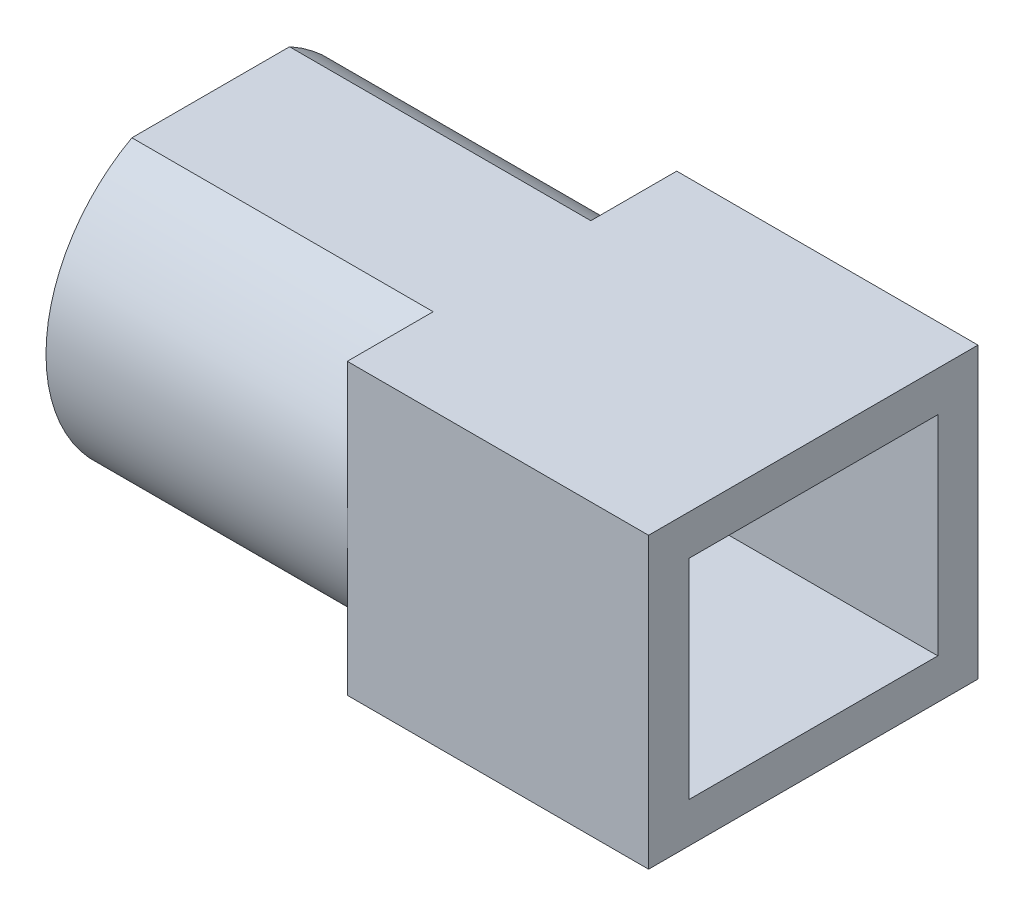
from build123d import *

# Parameters (mm, degrees)
BOSS_EXTRUDE1_START = 30
SKETCH1_W           = 16.4
SKETCH1_H           = 14.4
SKETCH1_W_2         = 12.4
SKETCH1_H_2         = 10.4
BOSS_EXTRUDE1_DEPTH = 15
BOSS_EXTRUDE2_START = 30
BOSS_EXTRUDE2_DEPTH = 15


with BuildPart() as part:
    # Sketch1 → Boss-Extrude1 (new body)
    with BuildSketch(Plane(origin=(0, 0, 0), x_dir=(0, 0, -1), z_dir=(1, 0, 0)).offset(BOSS_EXTRUDE1_START)):
        Rectangle(SKETCH1_W, SKETCH1_H)
        Rectangle(SKETCH1_W_2, SKETCH1_H_2, mode=Mode.SUBTRACT)
    extrude(amount=BOSS_EXTRUDE1_DEPTH)

    # Sketch2 → Boss-Extrude2 (add)
    with BuildSketch(Plane(origin=(0, 0, 0), x_dir=(0, 0, -1), z_dir=(1, 0, 0)).offset(BOSS_EXTRUDE2_START)):
        with BuildLine():
            Line((-3.924283374, 7.2), (3.924283374, 7.2))
            ThreePointArc((3.924283374, 7.2), (8.2, 0), (3.924283374, -7.2))
            Line((3.924283374, -7.2), (-3.924283374, -7.2))
            ThreePointArc((-3.924283374, -7.2), (-8.2, 0), (-3.924283374, 7.2))
        make_face()
        with BuildLine():
            Line((-3.376388603, 5.2), (3.376388603, 5.2))
            ThreePointArc((3.376388603, 5.2), (6.2, 0), (3.376388603, -5.2))
            Line((3.376388603, -5.2), (-3.376388603, -5.2))
            ThreePointArc((-3.376388603, -5.2), (-6.2, 0), (-3.376388603, 5.2))
        make_face(mode=Mode.SUBTRACT)
    extrude(amount=-BOSS_EXTRUDE2_DEPTH)


solid = part.part
